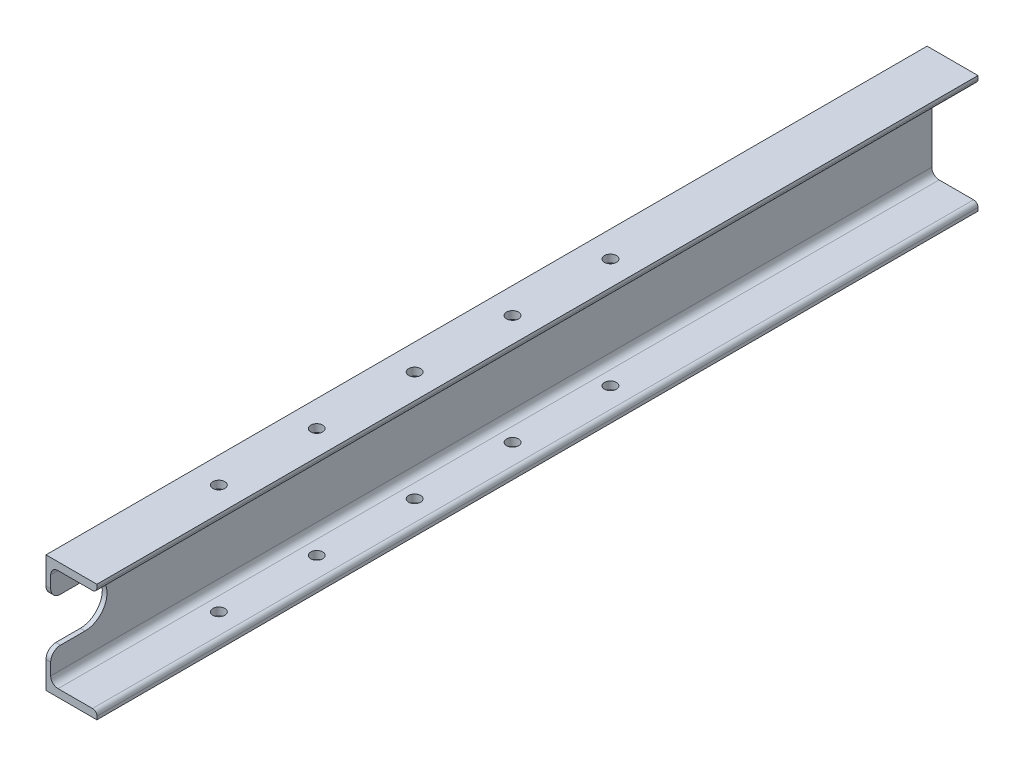
from build123d import *

# Parameters (mm, degrees)
EXTRUDE_1_DEPTH          = 450
CUT_EXTRUDE_1_DEPTH      = 5
FILLET_1_R               = 10
CUT_EXTRUDE_2_DEPTH      = 469.619248431
CUT_EXTRUDE_2_DEPTH_BACK = 469.619248431
SKETCH_3_R               = 6.1


with BuildPart() as part:
    # Эскиз1 → Бобышка-Вытянуть1 (new, symmetric)
    with BuildSketch(Plane.XY):
        with BuildLine():
            Line((0, -60), (0, 60))
            Line((0, 60), (52, 60))
            Line((52, 60), (52, 56.7))
            ThreePointArc((52, 56.7), (50.681980515, 53.518019485), (47.5, 52.2))
            Line((47.5, 52.2), (12.3, 52.2))
            ThreePointArc((12.3, 52.2), (6.996699141, 50.003300859), (4.8, 44.7))
            Line((4.8, 44.7), (4.8, -44.7))
            ThreePointArc((4.8, -44.7), (6.996699141, -50.003300859), (12.3, -52.2))
            Line((12.3, -52.2), (47.5, -52.2))
            ThreePointArc((47.5, -52.2), (50.681980515, -53.518019485), (52, -56.7))
            Line((52, -56.7), (52, -60))
            Line((52, -60), (0, -60))
        make_face()
    extrude(amount=EXTRUDE_1_DEPTH, both=True)

    # Эскиз2 → Вырез-Вытянуть1 (cut, symmetric)
    with BuildSketch(Plane.ZY):
        with BuildLine():
            Line((415, 22.5), (450, 22.5))
            Line((450, 22.5), (450, -22.5))
            Line((450, -22.5), (415, -22.5))
            ThreePointArc((415, -22.5), (392.5, 0), (415, 22.5))
        make_face()
    extrude(amount=CUT_EXTRUDE_1_DEPTH, both=True, mode=Mode.SUBTRACT)

    # Скругление1
    fillet_1_edges = [part.edges().sort_by_distance(p)[0] for p in [
        (2.4, -22.5, 450),
        (2.4, 22.5, 450),
    ]]
    fillet(fillet_1_edges, radius=FILLET_1_R)

    # Эскиз3 → Вырез-Вытянуть2 (cut, two sides: drawn at the far end of the back side and taken through both)
    with BuildSketch(Plane(origin=(0, 60, 0), x_dir=(1, 0, 0), z_dir=(0, 1, 0)).offset(-CUT_EXTRUDE_2_DEPTH_BACK)):
        with Locations(Location((26.550751723, -300, 0), (0, 0, 180))):
            Circle(SKETCH_3_R)
        with Locations(Location((26.550751723, -200, 0), (0, 0, 180))):
            Circle(SKETCH_3_R)
        with Locations(Location((26.550751723, -100, 0), (0, 0, 180))):
            Circle(SKETCH_3_R)
        with Locations(Location((26.550751723, 0, 0), (0, 0, 180))):
            Circle(SKETCH_3_R)
        with Locations(Location((26.550751723, 100, 0), (0, 0, 180))):
            Circle(SKETCH_3_R)
    extrude(amount=CUT_EXTRUDE_2_DEPTH + CUT_EXTRUDE_2_DEPTH_BACK, mode=Mode.SUBTRACT)


solid = part.part
